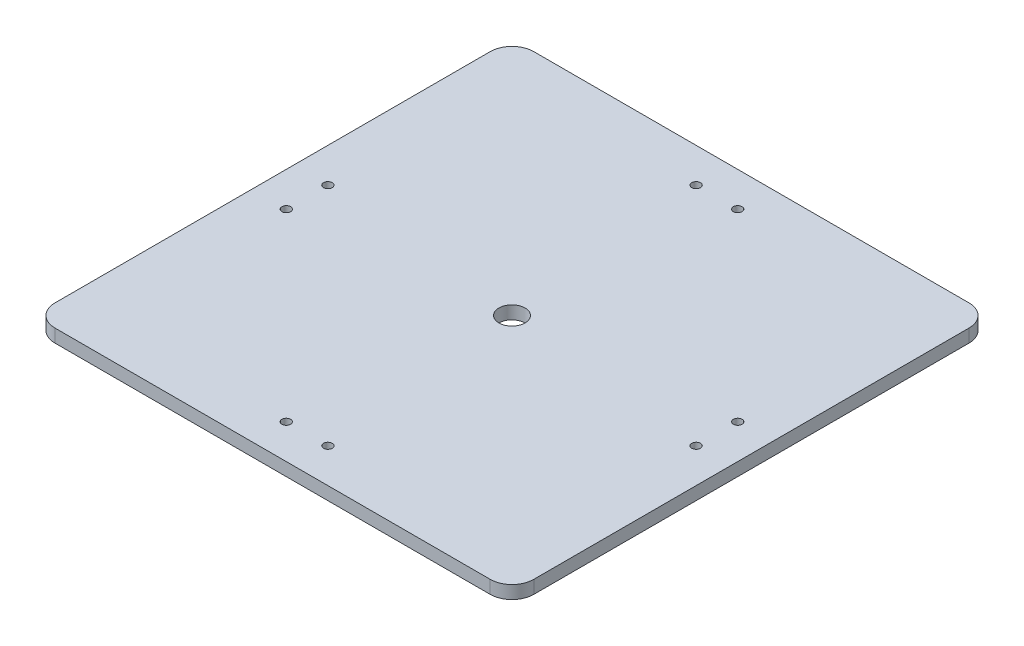
from build123d import *

# Parameters (mm, degrees)
SKETCH1_W                 = 220
SKETCH1_H                 = 220
BOSS_EXTRUDE1_DEPTH       = 6
SKETCH2_R                 = 6
CUT_EXTRUDE1_DEPTH        = 51
FILLET1_R                 = 10
F_4_0MM_DOWEL_HOLE1_D     = 4
F_4_0MM_DOWEL_HOLE1_DEPTH = 25.4
F_4_0MM_DOWEL_HOLE1_TIP   = 1.201721238


with BuildPart() as part:
    # Sketch1 → Boss-Extrude1 (new body)
    with BuildSketch(Plane(origin=(0, 0, 0), x_dir=(1, 0, 0), z_dir=(0, 1, 0))):
        Rectangle(SKETCH1_W, SKETCH1_H)
    extrude(amount=BOSS_EXTRUDE1_DEPTH)

    # Sketch2 → Cut-Extrude1 (cut)
    with BuildSketch(Plane(origin=(0, 6, 0), x_dir=(1, 0, 0), z_dir=(0, 1, 0))):
        with Locations(Location((0, 0, 0), (0, 0, 270))):
            Circle(SKETCH2_R)
    extrude(amount=-CUT_EXTRUDE1_DEPTH, mode=Mode.SUBTRACT)

    # Fillet1
    fillet1_edges = [part.edges().sort_by_distance(p)[0] for p in [
        (-110, 3, -110),
        (110, 3, -110),
        (110, 3, 110),
        (-110, 3, 110),
    ]]
    fillet(fillet1_edges, radius=FILLET1_R)

    # Ø4.0mm Dowel Hole1
    with Locations(Plane(origin=(0, 6, 0), x_dir=(1, 0, 0), z_dir=(0, 1, 0))):
        with Locations((-9.557884959, -94.152737777), (9.557884959, -94.152737777), (94.152737777, -9.557884959), (94.152737777, 9.557884959), (9.557884959, 94.152737777), (-9.557884959, 94.152737777), (-94.152737777, 9.557884959), (-94.152737777, -9.557884959)):
            Hole(F_4_0MM_DOWEL_HOLE1_D / 2, depth=F_4_0MM_DOWEL_HOLE1_DEPTH)
            with Locations((0, 0, -(F_4_0MM_DOWEL_HOLE1_DEPTH + F_4_0MM_DOWEL_HOLE1_TIP / 2))):  # 118° drill point
                Cone(0, F_4_0MM_DOWEL_HOLE1_D / 2, F_4_0MM_DOWEL_HOLE1_TIP, mode=Mode.SUBTRACT)


solid = part.part
